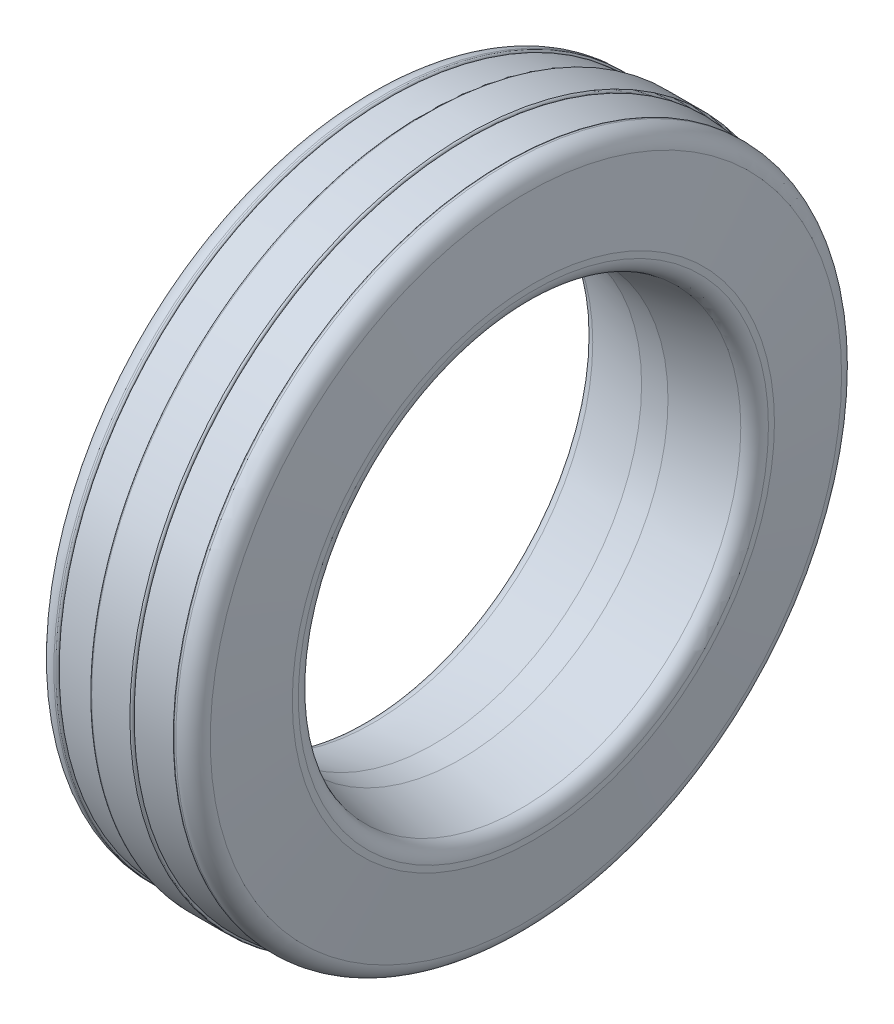
from build123d import *

# Parameters (mm, degrees)
BOSS_EXTRUDE1_DEPTH = 10


with BuildPart() as part:
    # Sketch1 → Revolve1 (revolve)
    with BuildSketch(Plane(origin=(0, 0, 0), x_dir=(1, 0, 0), z_dir=(0, 1, 0))):
        with BuildLine():
            Line((0, 26.461448078), (0, 26.5))
            Line((0, 26.5), (0.819900744, 34.699007438))
            ThreePointArc((0.819900744, 34.699007438), (1.467964483, 35.982905067), (2.809975124, 36.5))
            Line((2.809975124, 36.5), (3.006440678, 36.5))
            ThreePointArc((3.006440678, 36.5), (3.133719899, 36.447279221), (3.186440678, 36.32))
            Line((3.186440678, 36.32), (3.186440678, 36.3))
            Line((3.186440678, 36.3), (5.186440678, 36.5))
            Line((5.186440678, 36.5), (7.186440678, 36.7))
            Line((7.186440678, 36.7), (7.186440678, 36.73))
            ThreePointArc((7.186440678, 36.73), (7.250877186, 36.885563492), (7.406440678, 36.95))
            Line((7.406440678, 36.95), (11.606440678, 36.95))
            ThreePointArc((11.606440678, 36.95), (11.76200417, 36.885563492), (11.826440678, 36.73))
            Line((11.826440678, 36.73), (11.826440678, 36.7))
            Line((11.826440678, 36.7), (13.826440678, 36.5))
            Line((13.826440678, 36.5), (15.826440678, 36.3))
            Line((15.826440678, 36.3), (15.826440678, 36.32))
            ThreePointArc((15.826440678, 36.32), (15.879161457, 36.447279221), (16.006440678, 36.5))
            Line((16.006440678, 36.5), (16.202319923, 36.5))
            ThreePointArc((16.202319923, 36.5), (17.544330565, 35.982905067), (18.192394304, 34.699007438))
            Line((18.192394304, 34.699007438), (19.012295048, 26.5))
            Line((19.012295048, 26.5), (19.012295048, 26.461448078))
            Line((19.012295048, 26.461448078), (19.012295048, 25.83837849))
            ThreePointArc((19.012295048, 25.83837849), (18.625604685, 24.758925945), (17.641450582, 24.170548572))
            Line((17.641450582, 24.170548572), (10.957573077, 22.851448078))
            Line((10.957573077, 22.851448078), (8.055304768, 22.851448078))
            Line((8.055304768, 22.851448078), (1.370867666, 24.170562406))
            ThreePointArc((1.370867666, 24.170562406), (0.38669787, 24.758935223), (0, 25.838396902))
            Line((0, 25.838396902), (0, 26.461448078))
        make_face()
    revolve(axis=Axis((22, 0, 0), (-1, 0, 0)))

    # Sketch2 → Boss-Extrude1 (add)
    # profile 1 of 4: a face of its own
    with BuildSketch(Plane(origin=(0, 0, 0), x_dir=(0, 0, -1), z_dir=(1, 0, 0))):
        with BuildLine():
            Line((27.950284589, 0.624688704), (33.419911925, 1.063342958))
            Line((33.419911925, 1.063342958), (33.350536035, 1.922545629))
            add(Edge.make_bspline(
                [(33.350536035, 1.922545629), (33.345164689, 1.982671035), (33.334786675, 2.098839748), (33.317325331, 2.266385169), (33.296752204, 2.421219843), (33.275634267, 2.563298811), (33.251890565, 2.692764602), (33.225150173, 2.809007254), (33.198434969, 2.913281305), (33.176266444, 2.977395172), (33.165805411, 3.007649655)],
                knots=[0, 0, 0, 0, 1.312914666, 2.536691528, 3.663400462, 4.709810476, 5.660640449, 6.525114596, 7.304021157, 8, 8, 8, 8], degree=3))
            add(Edge.make_bspline(
                [(33.165805411, 3.007649655), (33.151242333, 3.046748869), (33.122516905, 3.123871416), (33.069934043, 3.234032025), (33.011076843, 3.337133906), (32.946273773, 3.43419116), (32.874068427, 3.523554798), (32.795635489, 3.606274061), (32.711802627, 3.683145554), (32.620855065, 3.751375134), (32.525463926, 3.81201455), (32.426349638, 3.86378802), (32.323792053, 3.905085024), (32.218158135, 3.937683444), (32.109352831, 3.962350763), (31.996731708, 3.974253278), (31.881161953, 3.980811019), (31.803476528, 3.975516483), (31.763986199, 3.972825078)],
                knots=[0, 0, 0, 0, 1.088201006, 2.146458335, 3.180491622, 4.183697023, 5.188000124, 6.174034934, 7.155730172, 8.151955391, 9.136312636, 10.102214488, 11.065212653, 12.016555707, 12.984546613, 13.970395168, 14.968278001, 16, 16, 16, 16], degree=3))
            add(Edge.make_bspline(
                [(31.763986199, 3.972825078), (31.713140939, 3.967481964), (31.61346777, 3.957007732), (31.469048283, 3.91973895), (31.333419257, 3.86670968), (31.204612527, 3.79812002), (31.08474948, 3.708705521), (30.969204543, 3.6019621), (30.861423575, 3.472970544), (30.797034553, 3.377075672), (30.763722259, 3.327463517)],
                knots=[0, 0, 0, 0, 0.988826636, 1.93842031, 2.877088285, 3.80363831, 4.754535695, 5.764310944, 6.843344269, 8, 8, 8, 8], degree=3))
            add(Edge.make_bspline(
                [(30.763722259, 3.327463517), (30.740897752, 3.366429983), (30.696312659, 3.442546567), (30.622881513, 3.549472372), (30.546931034, 3.648061465), (30.468099456, 3.738273464), (30.385559726, 3.819264968), (30.300184434, 3.891808229), (30.211965528, 3.956138723), (30.120071385, 4.010995885), (30.025272862, 4.056962953), (29.927936817, 4.096958852), (29.826775637, 4.128374976), (29.722336392, 4.15336101), (29.61400132, 4.169417757), (29.50258923, 4.177987465), (29.387505681, 4.180232423), (29.310039843, 4.175537678), (29.270556139, 4.173144804)],
                knots=[0, 0, 0, 0, 1.186043934, 2.316802652, 3.40481078, 4.454100606, 5.461387198, 6.439844665, 7.394953455, 8.326378176, 9.247199048, 10.160559649, 11.088229115, 12.027069715, 12.979054673, 13.961878581, 14.961186172, 16, 16, 16, 16], degree=3))
            add(Edge.make_bspline(
                [(29.270556139, 4.173144804), (29.195211324, 4.164664596), (29.046833755, 4.147964408), (28.83379148, 4.081782405), (28.631605685, 3.992886127), (28.44715766, 3.871628676), (28.280203789, 3.731222377), (28.137346612, 3.57217845), (28.01768003, 3.399140754), (27.94089827, 3.241170327), (27.892254085, 3.105751547), (27.864064063, 2.994715595), (27.839651198, 2.875836127), (27.826063248, 2.748022482), (27.814002051, 2.612262548), (27.812887788, 2.467911703), (27.815258709, 2.315113755), (27.822878388, 2.21070612), (27.82679997, 2.156971172)],
                knots=[0, 0, 0, 0, 1.296177508, 2.552579994, 3.804058116, 5.068891295, 6.319436027, 7.531925589, 8.720145099, 9.912305592, 10.528900447, 11.182394755, 11.873109601, 12.605949539, 13.382657835, 14.207054754, 15.077233952, 16, 16, 16, 16], degree=3))
            Line((27.82679997, 2.156971172), (27.950284589, 0.624688704))
        make_face()
        with BuildLine():
            Line((32.343382253, 2.02476314), (31.189873125, 1.932856996))
            Line((31.189873125, 1.932856996), (31.171430823, 2.159755437))
            add(Edge.make_bspline(
                [(31.171430823, 2.159755437), (31.168516745, 2.219056327), (31.163037419, 2.3305595), (31.179447434, 2.488182416), (31.21911994, 2.623902763), (31.281403376, 2.736974975), (31.363869484, 2.827285153), (31.464579403, 2.892504316), (31.580059229, 2.938267385), (31.663625033, 2.94858746), (31.707156474, 2.953963436)],
                knots=[0, 0, 0, 0, 1.308824268, 2.460975878, 3.47942728, 4.408411743, 5.285507183, 6.148677492, 7.035601473, 8, 8, 8, 8], degree=3))
            add(Edge.make_bspline(
                [(31.707156474, 2.953963436), (31.748210069, 2.955716734), (31.827291278, 2.959094097), (31.941014622, 2.933102104), (32.04301138, 2.885416808), (32.133175026, 2.814142031), (32.208426194, 2.717781345), (32.264408278, 2.596463933), (32.305556866, 2.452785784), (32.316139013, 2.348094358), (32.321764811, 2.292437149)],
                knots=[0, 0, 0, 0, 0.959154128, 1.847610858, 2.702079514, 3.57904366, 4.515146281, 5.538831868, 6.691566684, 8, 8, 8, 8], degree=3))
            Line((32.321764811, 2.292437149), (32.343382253, 2.02476314))
        make_face(mode=Mode.SUBTRACT)
        with BuildLine():
            Line((30.261260599, 1.857957172), (28.85892036, 1.745216151))
            Line((28.85892036, 1.745216151), (28.838521095, 2.005274635))
            add(Edge.make_bspline(
                [(28.838521095, 2.005274635), (28.834613874, 2.057136731), (28.827143637, 2.156292141), (28.823384523, 2.299015466), (28.825573904, 2.42905065), (28.834646104, 2.546669715), (28.848687479, 2.65154589), (28.867859187, 2.744163077), (28.895093735, 2.823428403), (28.928799878, 2.890970831), (28.968481992, 2.94832937), (29.013220349, 2.997926053), (29.062827127, 3.041584447), (29.118948056, 3.076590346), (29.179004541, 3.106787437), (29.244713868, 3.129580362), (29.315594547, 3.145110515), (29.364940515, 3.150658996), (29.390144362, 3.153492927)],
                knots=[0, 0, 0, 0, 1.718091301, 3.284827672, 4.715201579, 6.013041244, 7.179885683, 8.209597292, 9.132467725, 9.940695488, 10.695907447, 11.429261821, 12.143083691, 12.871199752, 13.608058946, 14.360145338, 15.162431178, 16, 16, 16, 16], degree=3))
            add(Edge.make_bspline(
                [(29.390144362, 3.153492927), (29.419007572, 3.155036992), (29.475024082, 3.15803365), (29.557559785, 3.15170019), (29.636095283, 3.137317132), (29.711583324, 3.115543884), (29.781689823, 3.081810025), (29.849353914, 3.042713024), (29.911736155, 2.99278928), (29.970706442, 2.934974403), (30.024606198, 2.86645975), (30.072434041, 2.786618984), (30.116610291, 2.696085628), (30.151921993, 2.593021048), (30.183427279, 2.479578911), (30.209958378, 2.354908078), (30.230586097, 2.218496647), (30.23906465, 2.123281696), (30.243470618, 2.073802265)],
                knots=[0, 0, 0, 0, 0.888350056, 1.724072601, 2.538685092, 3.342018578, 4.131572287, 4.925638689, 5.741034085, 6.58155289, 7.46153163, 8.413939781, 9.439697334, 10.554178556, 11.759271448, 13.06015233, 14.472277856, 16, 16, 16, 16], degree=3))
            Line((30.243470618, 2.073802265), (30.261260599, 1.857957172))
        make_face(mode=Mode.SUBTRACT)
    # profile 2 of 4: a face of its own
    with BuildSketch(Plane(origin=(0, 0, 0), x_dir=(0, 0, -1), z_dir=(1, 0, 0))):
        Polygon((31.947672059, 9.859263764), (30.950192117, 12.676983151), (29.987640507, 12.336538094), (30.639804854, 10.494427839), (29.707324395, 10.164083944), (29.055160048, 12.006194199), (28.10978789, 11.672529045), (28.761952238, 9.83041879), (27.404382168, 9.349694605), (26.752217821, 11.19180486), (25.78640183, 10.850142169), (26.783881773, 8.032422783), align=None)
    # profile 3 of 4: a face of its own
    with BuildSketch(Plane(origin=(0, 0, 0), x_dir=(0, 0, -1), z_dir=(1, 0, 0))):
        with BuildLine():
            Line((28.417539045, 17.56906347), (27.79612633, 18.480612967))
            add(Edge.make_bspline(
                [(27.79612633, 18.480612967), (27.754597115, 18.540439626), (27.674663912, 18.655590768), (27.555235158, 18.818850452), (27.438706671, 18.964175947), (27.329790596, 19.095184007), (27.224003806, 19.208550918), (27.124924851, 19.30715831), (27.02947589, 19.38879414), (26.909863379, 19.474858561), (26.756518808, 19.557133028), (26.562284827, 19.62610907), (26.35604003, 19.66281517), (26.177580186, 19.667602239), (26.03261582, 19.655078464), (25.922509928, 19.639121376), (25.813599485, 19.612642895), (25.704707178, 19.579130643), (25.597343599, 19.53538527), (25.489305551, 19.484999225), (25.382458837, 19.42532096), (25.313307859, 19.379832027), (25.278380995, 19.35685642)],
                knots=[0, 0, 0, 0, 1.424182825, 2.741190649, 3.954484429, 5.066429958, 6.071800544, 6.98558, 7.798675415, 8.525028805, 9.86388452, 11.18603223, 12.539581193, 13.943465317, 14.662933685, 15.383583947, 16.116687354, 16.85245941, 17.609548583, 18.381713909, 19.182634014, 20, 20, 20, 20], degree=3))
            add(Edge.make_bspline(
                [(25.278380995, 19.35685642), (25.242224594, 19.33154576), (25.171448238, 19.282000002), (25.074638888, 19.19917535), (24.985429819, 19.114716945), (24.905760363, 19.025957234), (24.835383337, 18.933974353), (24.774497609, 18.838203205), (24.720971164, 18.739714153), (24.679248772, 18.636036775), (24.643892166, 18.529801817), (24.620806358, 18.419166746), (24.604509385, 18.305539277), (24.598244674, 18.188237564), (24.600965181, 18.067400175), (24.613479111, 17.942764506), (24.633571306, 17.814254039), (24.654797584, 17.728418734), (24.665586276, 17.684791174)],
                knots=[0, 0, 0, 0, 1.103867388, 2.160826527, 3.184661192, 4.176437399, 5.142194278, 6.079455413, 7.014234928, 7.942667661, 8.872554906, 9.812380987, 10.766478756, 11.743020719, 12.748331385, 13.788210487, 14.875812468, 16, 16, 16, 16], degree=3))
            Line((24.665586276, 17.684791174), (21.931299735, 17.383701289))
            Line((21.931299735, 17.383701289), (22.571572664, 16.44469674))
            Line((22.571572664, 16.44469674), (25.17686553, 16.733398493))
            Line((25.17686553, 16.733398493), (25.230766769, 16.65326036))
            Line((25.230766769, 16.65326036), (23.318795529, 15.349295825))
            Line((23.318795529, 15.349295825), (23.905167218, 14.49042941))
            Line((23.905167218, 14.49042941), (28.417539045, 17.56906347))
        make_face()
        with BuildLine():
            Line((26.067258535, 17.224703946), (25.882988681, 17.495200587))
            add(Edge.make_bspline(
                [(25.882988681, 17.495200587), (25.861016328, 17.528328586), (25.818780415, 17.592008215), (25.76218122, 17.686379466), (25.713341639, 17.774492913), (25.67481952, 17.857845915), (25.642276678, 17.934126845), (25.621821421, 18.006093229), (25.607215489, 18.071400602), (25.601645264, 18.150930587), (25.616567927, 18.246245064), (25.666217614, 18.352508679), (25.746918172, 18.450688601), (25.817534391, 18.503205272), (25.85525294, 18.531256231)],
                knots=[0, 0, 0, 0, 1.198681457, 2.304141333, 3.318093892, 4.234701164, 5.073019811, 5.815171851, 6.487967073, 7.087486865, 8.210725061, 9.353452217, 10.586387888, 12, 12, 12, 12], degree=3))
            add(Edge.make_bspline(
                [(25.85525294, 18.531256231), (25.879401712, 18.54648352), (25.927098587, 18.576559341), (26.00404087, 18.607634213), (26.08305129, 18.625601709), (26.162590403, 18.631109178), (26.241588358, 18.623470904), (26.318847315, 18.606299841), (26.391955491, 18.574633577), (26.450569047, 18.539052873), (26.496794105, 18.502004939), (26.53557676, 18.466521969), (26.576958412, 18.422778207), (26.622934487, 18.372504064), (26.668311505, 18.311834425), (26.720323011, 18.246012757), (26.77489012, 18.171876741), (26.810870721, 18.118726341), (26.829544348, 18.091141734)],
                knots=[0, 0, 0, 0, 1.119727065, 2.211602415, 3.239874977, 4.291756873, 5.32809286, 6.348136265, 7.387179536, 8.442616431, 9.03124423, 9.711698053, 10.505630016, 11.39593568, 12.385535509, 13.479029652, 14.691637757, 16, 16, 16, 16], degree=3))
            Line((26.829544348, 18.091141734), (26.990395524, 17.854607235))
            Line((26.990395524, 17.854607235), (26.067258535, 17.224703946))
        make_face(mode=Mode.SUBTRACT)
    # profile 4 of 4: a face of its own
    with BuildSketch(Plane(origin=(0, 0, 0), x_dir=(0, 0, -1), z_dir=(1, 0, 0))):
        with BuildLine():
            add(Edge.make_bspline(
                [(20.677687185, 26.273013027), (20.601225017, 26.330007424), (20.450344738, 26.442472592), (20.207284843, 26.580752651), (19.958262659, 26.696391691), (19.69916498, 26.781409211), (19.432150266, 26.840136556), (19.156796562, 26.871435647), (18.873361636, 26.875487655), (18.585474003, 26.853219774), (18.300207322, 26.804467177), (18.024144807, 26.732279616), (17.761967633, 26.632218698), (17.512975947, 26.507345918), (17.277185912, 26.357210981), (17.055607003, 26.181439439), (16.846845199, 25.98127807), (16.722336779, 25.831344966), (16.659072978, 25.755162663)],
                knots=[0, 0, 0, 0, 1.015148363, 2.003158839, 2.97294228, 3.935969553, 4.901909433, 5.88101691, 6.883142811, 7.917480506, 8.952816758, 9.962551925, 10.952574644, 11.936773856, 12.92540392, 13.925029024, 14.945689368, 16, 16, 16, 16], degree=3))
            add(Edge.make_bspline(
                [(16.659072978, 25.755162663), (16.599901971, 25.676703292), (16.4832887, 25.522076824), (16.339600175, 25.273693113), (16.22094842, 25.020085415), (16.131493064, 24.758848157), (16.068251209, 24.49101381), (16.033342578, 24.215885799), (16.026807655, 23.933925223), (16.046191706, 23.648771436), (16.091356011, 23.366771799), (16.161957981, 23.095233885), (16.258567131, 22.837629768), (16.378677633, 22.59300896), (16.524229222, 22.362278582), (16.694622391, 22.145462058), (16.888586754, 21.941224961), (17.034955398, 21.820186031), (17.109234207, 21.758761486)],
                knots=[0, 0, 0, 0, 1.052387464, 2.074028329, 3.068652156, 4.04918037, 5.027905647, 6.013327765, 7.015856546, 8.046037441, 9.072451665, 10.072419546, 11.047878432, 12.016163674, 12.988289416, 13.965882206, 14.967730782, 16, 16, 16, 16], degree=3))
            add(Edge.make_bspline(
                [(17.109234207, 21.758761486), (17.18986591, 21.698160037), (17.348220669, 21.579143231), (17.602480263, 21.433134488), (17.860577662, 21.312106967), (18.126289434, 21.222078157), (18.39838753, 21.163110979), (18.676213868, 21.130143445), (18.960232873, 21.128914643), (19.246852373, 21.155596453), (19.529745234, 21.20798727), (19.802345108, 21.28460388), (20.06118825, 21.385690428), (20.30580135, 21.510665787), (20.537231831, 21.658589963), (20.753865028, 21.830956874), (20.957950985, 22.026203504), (21.079214365, 22.172614277), (21.140692813, 22.246842022)],
                knots=[0, 0, 0, 0, 1.069180572, 2.099792321, 3.103798238, 4.08962449, 5.068923273, 6.052568226, 7.052339267, 8.076108619, 9.10225507, 10.100438153, 11.075729447, 12.045307283, 13.010090192, 13.984556202, 14.978204646, 16, 16, 16, 16], degree=3))
            add(Edge.make_bspline(
                [(21.140692813, 22.246842022), (21.179873102, 22.29830051), (21.2577772, 22.400617955), (21.361268382, 22.561934696), (21.453322225, 22.727359444), (21.5339275, 22.896738561), (21.60388015, 23.070163049), (21.660535475, 23.24842309), (21.704968009, 23.43090453), (21.738310942, 23.616427876), (21.759844975, 23.803663626), (21.769664075, 23.990618944), (21.76503935, 24.176092125), (21.751167202, 24.360257233), (21.722370269, 24.543148828), (21.682048912, 24.724970192), (21.62921332, 24.905667669), (21.564740655, 25.084326898), (21.488853206, 25.258680554), (21.403023455, 25.426499596), (21.307737804, 25.586984566), (21.201295145, 25.739326405), (21.086055425, 25.885441912), (20.959422965, 26.022598251), (20.823776344, 26.152875741), (20.726607842, 26.232782835), (20.677687185, 26.273013027)],
                knots=[0, 0, 0, 0, 1.033205417, 2.054373208, 3.059495022, 4.056721532, 5.050054876, 6.045483771, 7.042917491, 8.049374833, 9.055695279, 10.052921789, 11.038317808, 12.018614969, 13.002139223, 13.994119369, 14.992916139, 16.008486503, 17.027375069, 18.029476842, 19.01886689, 20.007368834, 20.997263526, 21.990250072, 22.988167111, 24, 24, 24, 24], degree=3))
        make_face()
        with BuildLine():
            add(Edge.make_bspline(
                [(20.054413515, 25.464269663), (20.101933711, 25.424619047), (20.195612203, 25.346454175), (20.321489758, 25.216543168), (20.429940052, 25.077057789), (20.524141087, 24.93050261), (20.600235447, 24.77420195), (20.659882097, 24.609714047), (20.705484341, 24.437330594), (20.731919274, 24.258230598), (20.743804505, 24.076757914), (20.735810027, 23.896477789), (20.71040403, 23.718866783), (20.665766813, 23.544628971), (20.603352338, 23.373552021), (20.522425776, 23.205927927), (20.42370889, 23.040624823), (20.345175036, 22.936221061), (20.305066839, 22.882900787)],
                knots=[0, 0, 0, 0, 1.024267061, 2.019179277, 2.987936475, 3.945580116, 4.898637306, 5.859576564, 6.83875499, 7.845691811, 8.852426644, 9.845553329, 10.827936313, 11.818042611, 12.818144419, 13.838124652, 14.895903893, 16, 16, 16, 16], degree=3))
            add(Edge.make_bspline(
                [(20.305066839, 22.882900787), (20.258097273, 22.826051353), (20.166034964, 22.71462409), (20.011248438, 22.568643142), (19.847761811, 22.444335976), (19.676384215, 22.341005652), (19.49505603, 22.260756463), (19.305538719, 22.202925694), (19.107040715, 22.165682801), (18.971594539, 22.159296895), (18.902714147, 22.156049378)],
                knots=[0, 0, 0, 0, 1.080845964, 2.118503215, 3.112336058, 4.088611445, 5.046947226, 6.013018639, 6.989531786, 8, 8, 8, 8], degree=3))
            add(Edge.make_bspline(
                [(18.902714147, 22.156049378), (18.849064526, 22.156622018), (18.742776097, 22.157756508), (18.585376665, 22.174447993), (18.432107167, 22.204741344), (18.283294487, 22.248332169), (18.138878722, 22.304459422), (17.999102126, 22.373639282), (17.862969725, 22.455391043), (17.777366374, 22.519501238), (17.733981138, 22.551993378)],
                knots=[0, 0, 0, 0, 1.022409984, 2.025556707, 3.012346949, 3.997123306, 4.977934457, 5.962212924, 6.967214797, 8, 8, 8, 8], degree=3))
            add(Edge.make_bspline(
                [(17.733981138, 22.551993378), (17.687311099, 22.590627432), (17.595234221, 22.666849848), (17.473697203, 22.796113295), (17.367302446, 22.933685569), (17.275906062, 23.080119757), (17.200990697, 23.236121154), (17.141877138, 23.400769228), (17.099660987, 23.574268432), (17.071547279, 23.754247675), (17.061599994, 23.936884594), (17.067255057, 24.117911625), (17.093556996, 24.294671461), (17.136022692, 24.467707035), (17.195049965, 24.637021085), (17.273450392, 24.801455202), (17.368504204, 24.96262011), (17.44449835, 25.063731642), (17.48317542, 25.115192155)],
                knots=[0, 0, 0, 0, 1.012992261, 1.998566287, 2.961345805, 3.919406751, 4.881264039, 5.851720676, 6.841138154, 7.864884744, 8.895488189, 9.897478811, 10.890287521, 11.87976225, 12.875230103, 13.884880225, 14.923513994, 16, 16, 16, 16], degree=3))
            add(Edge.make_bspline(
                [(17.48317542, 25.115192155), (17.523778624, 25.164612787), (17.603916509, 25.262153485), (17.73900533, 25.391459754), (17.880985302, 25.506116383), (18.03172348, 25.603967375), (18.190568577, 25.685437956), (18.357790307, 25.750910886), (18.533173064, 25.7997592), (18.714691334, 25.832011755), (18.897797832, 25.84797765), (19.078409845, 25.848004942), (19.254394788, 25.828803641), (19.424999983, 25.791147446), (19.591161168, 25.736801642), (19.751633542, 25.663814505), (19.90762046, 25.573568628), (20.004888163, 25.50114518), (20.054413515, 25.464269663)],
                knots=[0, 0, 0, 0, 1.061576358, 2.095216036, 3.099438905, 4.089180082, 5.074550355, 6.059750677, 7.066933569, 8.093565439, 9.11760244, 10.116270248, 11.088773472, 12.051837215, 13.013354176, 13.98708106, 14.975091262, 16, 16, 16, 16], degree=3))
        make_face(mode=Mode.SUBTRACT)
    extrude(amount=BOSS_EXTRUDE1_DEPTH)


solid = part.part
